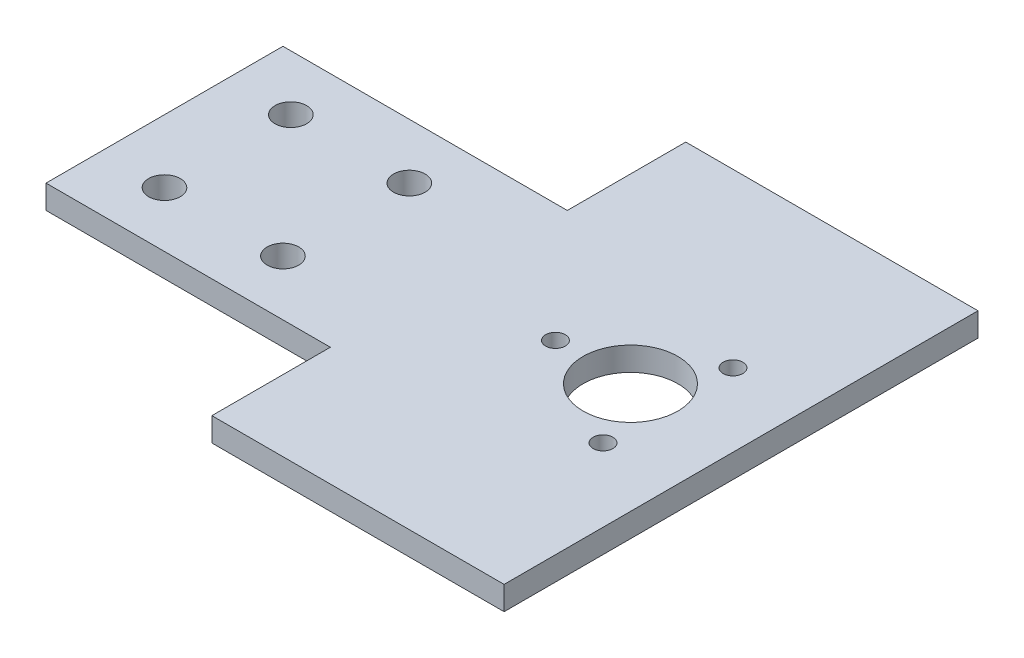
from build123d import *

# Parameters (mm, degrees)
EXTRUDE_1_DEPTH     = 3
SKETCH_2_R          = 2
SKETCH_2_R_2        = 6
CUT_EXTRUDE_1_DEPTH = 3
SKETCH_3_R          = 1.25
CUT_EXTRUDE_2_DEPTH = 3


with BuildPart() as part:
    # 草图1 → 凸台-拉伸1 (new body)
    with BuildSketch(Plane(origin=(0, 0, 0), x_dir=(1, 0, 0), z_dir=(0, 1, 0))):
        Polygon((0, 0), (0, 30), (36, 30), (36, 45), (73, 45), (73, -15), (36, -15), (36, 0), align=None)
    extrude(amount=EXTRUDE_1_DEPTH)

    # 草图2 → 切除-拉伸1 (cut)
    with BuildSketch(Plane(origin=(0, 3, 0), x_dir=(1, 0, 0), z_dir=(0, 1, 0))):
        with Locations(Location((8, 23, 0), (0, 0, 270))):
            Circle(SKETCH_2_R)
        with Locations(Location((23, 23, 0), (0, 0, 270))):
            Circle(SKETCH_2_R)
        with Locations(Location((8, 7, 0), (0, 0, 270))):
            Circle(SKETCH_2_R)
        with Locations(Location((23, 7, 0), (0, 0, 270))):
            Circle(SKETCH_2_R)
        with Locations(Location((59, 15, 0), (0, 0, 270))):
            Circle(SKETCH_2_R_2)
    extrude(amount=-CUT_EXTRUDE_1_DEPTH, mode=Mode.SUBTRACT)

    # 草图3 → 切除-拉伸2 (cut)
    with BuildSketch(Plane(origin=(0, 3, 0), x_dir=(1, 0, 0), z_dir=(0, 1, 0))):
        with Locations(Location((63.75, 23.227241336, 0), (0, 0, 270))):
            Circle(SKETCH_3_R)
        with Locations(Location((63.75, 6.772758664, 0), (0, 0, 270))):
            Circle(SKETCH_3_R)
        with Locations(Location((49.5, 15, 0), (0, 0, 270))):
            Circle(SKETCH_3_R)
    extrude(amount=-CUT_EXTRUDE_2_DEPTH, mode=Mode.SUBTRACT)


solid = part.part
